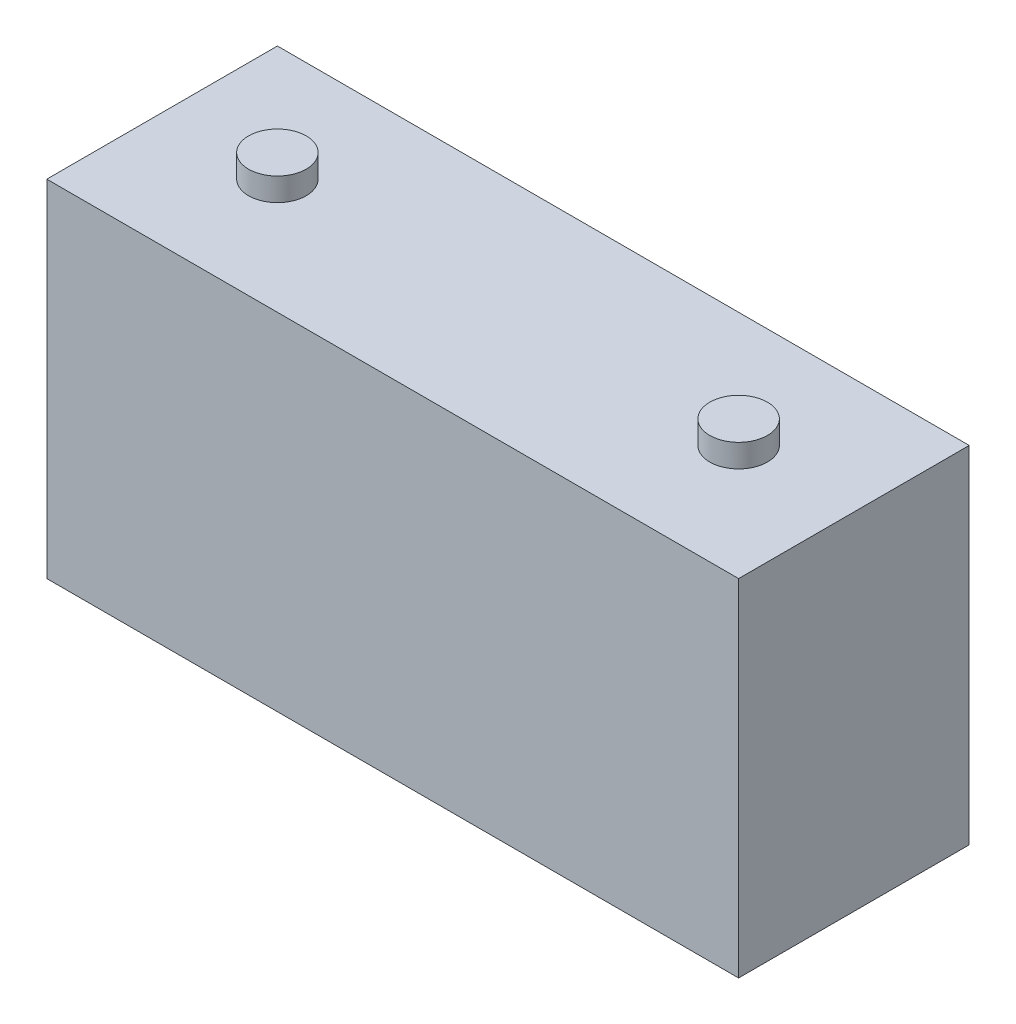
from build123d import *

# Parameters (mm, degrees)
SKETCH_1_W      = 600
SKETCH_1_H      = 300
EXTRUDE_1_DEPTH = 200
SKETCH_2_R      = 25
EXTRUDE_2_DEPTH = 20
EXTRUDE_START   = 20
SKETCH_3_R      = 25
EXTRUDE_3_DEPTH = 20


with BuildPart() as part:
    # 草图1 → 凸台-拉伸1 (new body)
    with BuildSketch(Plane.XY):
        Rectangle(SKETCH_1_W, SKETCH_1_H)
    extrude(amount=EXTRUDE_1_DEPTH)

    # 草图2 → 凸台-拉伸2 (add)
    with BuildSketch(Plane.XZ.offset(150)):
        with Locations(Location((-200, 100, 0), (0, 0, 90))):
            Circle(SKETCH_2_R)
        with Locations(Location((200, 100, 0), (0, 0, 90))):
            Circle(SKETCH_2_R)
    extrude(amount=EXTRUDE_2_DEPTH)

    # 草图3 → 凸台-拉伸3 (add)
    with BuildSketch(Plane(origin=(0, 150, 0), x_dir=(1, 0, 0), z_dir=(0, 1, 0)).offset(EXTRUDE_START)):
        with Locations(Location((200, -100, 0), (0, 0, 270))):
            Circle(SKETCH_3_R)
        with Locations(Location((-200, -100, 0), (0, 0, 270))):
            Circle(SKETCH_3_R)
    extrude(amount=-EXTRUDE_3_DEPTH)


solid = part.part
